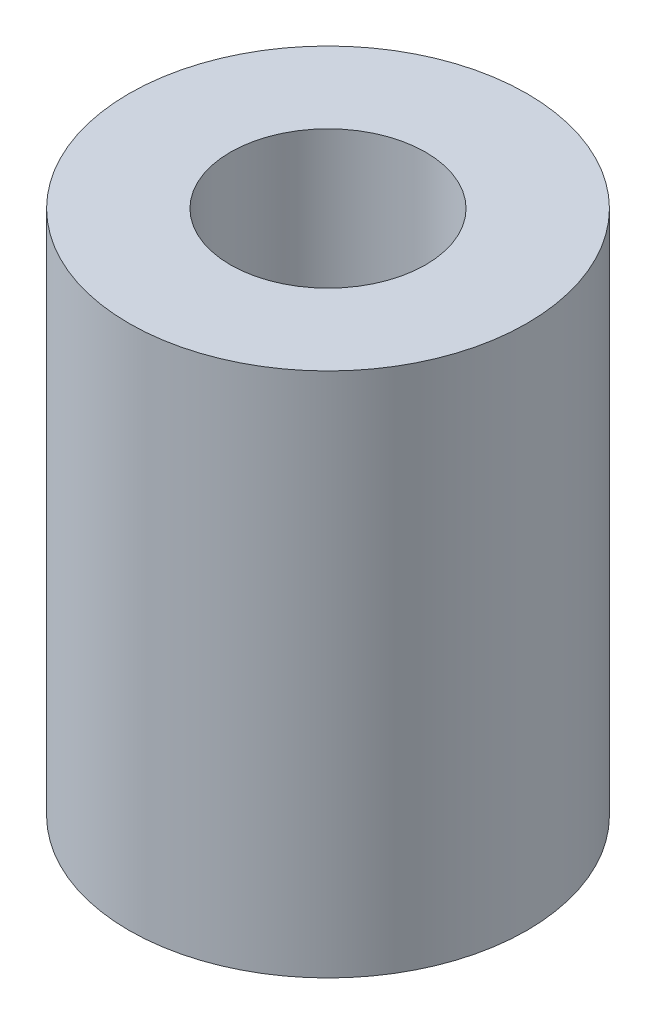
from build123d import *

# Parameters (mm, degrees)
SKETCH1_R           = 2.65
SKETCH1_R_2         = 1.3
BOSS_EXTRUDE1_DEPTH = 7


with BuildPart() as part:
    # Sketch1 → Boss-Extrude1 (new body)
    with BuildSketch(Plane(origin=(0, 0, 0), x_dir=(1, 0, 0), z_dir=(0, 1, 0))):
        with Locations(Location((0, 0, 0), (0, 0, 270))):
            Circle(SKETCH1_R)
        with Locations(Location((0, 0, 0), (0, 0, 270))):
            Circle(SKETCH1_R_2, mode=Mode.SUBTRACT)
    extrude(amount=BOSS_EXTRUDE1_DEPTH)


solid = part.part
